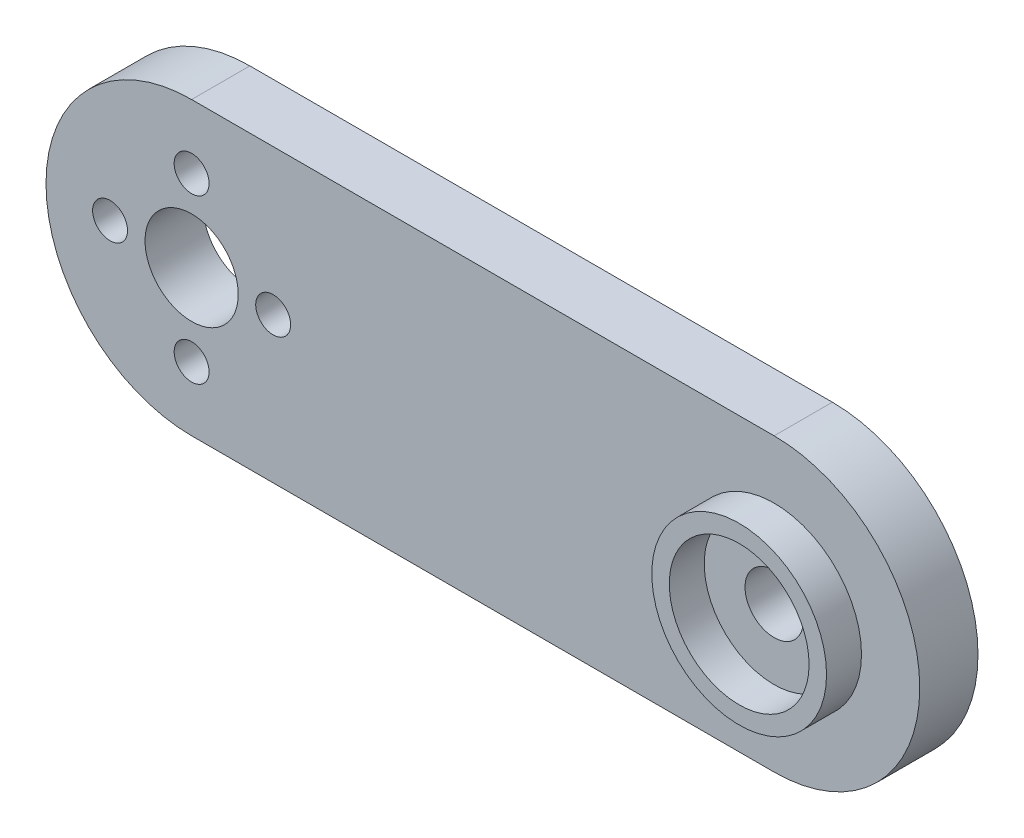
from build123d import *

# Parameters (mm, degrees)
SKETCH1_R           = 12.5
SKETCH1_W           = 50
SKETCH1_H           = 25
BOSS_EXTRUDE2_DEPTH = 5
CUT_EXTRUDE3_REACH  = 69.5
SKETCH3_R           = 4
SKETCH3_R_2         = 2.5
SKETCH3_3_R         = 7.5
SKETCH3_3_R_2       = 6
BOSS_EXTRUDE3_DEPTH = 3
CUT_EXTRUDE4_REACH  = 69.5
SKETCH3_4_R         = 1.5


with BuildPart() as part:
    # Sketch1 → Boss-Extrude2 (new body)
    with BuildSketch(Plane.XY):
        with Locations((0, 12.5)):
            Circle(SKETCH1_R)
        with Locations((50, 12.5)):
            Circle(SKETCH1_R)
        with Locations((25, 12.5)):
            Rectangle(SKETCH1_W, SKETCH1_H)
    extrude(amount=BOSS_EXTRUDE2_DEPTH)

    # Sketch3 → Cut-Extrude3 (cut, up to next)
    with BuildSketch(Plane.XY.offset(5), mode=Mode.PRIVATE) as cut_extrude3_sk1:
        with Locations((0, 12.5)):
            Circle(SKETCH3_R)
    cut_extrude3_tool1 = extrude(cut_extrude3_sk1.sketch, amount=-CUT_EXTRUDE3_REACH, mode=Mode.PRIVATE) & part.part
    # Sketch3 → Cut-Extrude3 (cut, up to next)
    with BuildSketch(Plane.XY.offset(5), mode=Mode.PRIVATE) as cut_extrude3_sk2:
        with Locations((50, 12.5)):
            Circle(SKETCH3_R_2)
    cut_extrude3_tool2 = extrude(cut_extrude3_sk2.sketch, amount=-CUT_EXTRUDE3_REACH, mode=Mode.PRIVATE) & part.part
    add(cut_extrude3_tool1.solids().sort_by_distance((0, 12.5, 5))[0], mode=Mode.SUBTRACT)
    add(cut_extrude3_tool2.solids().sort_by_distance((50, 12.5, 5))[0], mode=Mode.SUBTRACT)

    # Sketch3<3> → Boss-Extrude3 (add)
    with BuildSketch(Plane.XY.offset(5)):
        with Locations((50, 12.5)):
            Circle(SKETCH3_3_R)
        with Locations((50, 12.5)):
            Circle(SKETCH3_3_R_2, mode=Mode.SUBTRACT)
    extrude(amount=BOSS_EXTRUDE3_DEPTH)

    # Sketch3<4> → Cut-Extrude4 (cut, up to next)
    with BuildSketch(Plane.XY.offset(5), mode=Mode.PRIVATE) as cut_extrude4_sk1:
        with Locations((-7, 12.5)):
            Circle(SKETCH3_4_R)
    cut_extrude4_tool1 = extrude(cut_extrude4_sk1.sketch, amount=-CUT_EXTRUDE4_REACH, mode=Mode.PRIVATE) & part.part
    # Sketch3<4> → Cut-Extrude4 (cut, up to next)
    with BuildSketch(Plane.XY.offset(5), mode=Mode.PRIVATE) as cut_extrude4_sk2:
        with Locations((0, 19.5)):
            Circle(SKETCH3_4_R)
    cut_extrude4_tool2 = extrude(cut_extrude4_sk2.sketch, amount=-CUT_EXTRUDE4_REACH, mode=Mode.PRIVATE) & part.part
    # Sketch3<4> → Cut-Extrude4 (cut, up to next)
    with BuildSketch(Plane.XY.offset(5), mode=Mode.PRIVATE) as cut_extrude4_sk3:
        with Locations((7, 12.5)):
            Circle(SKETCH3_4_R)
    cut_extrude4_tool3 = extrude(cut_extrude4_sk3.sketch, amount=-CUT_EXTRUDE4_REACH, mode=Mode.PRIVATE) & part.part
    # Sketch3<4> → Cut-Extrude4 (cut, up to next)
    with BuildSketch(Plane.XY.offset(5), mode=Mode.PRIVATE) as cut_extrude4_sk4:
        with Locations((0, 5.5)):
            Circle(SKETCH3_4_R)
    cut_extrude4_tool4 = extrude(cut_extrude4_sk4.sketch, amount=-CUT_EXTRUDE4_REACH, mode=Mode.PRIVATE) & part.part
    add(cut_extrude4_tool1.solids().sort_by_distance((-7, 12.5, 5))[0], mode=Mode.SUBTRACT)
    add(cut_extrude4_tool2.solids().sort_by_distance((0, 19.5, 5))[0], mode=Mode.SUBTRACT)
    add(cut_extrude4_tool3.solids().sort_by_distance((7, 12.5, 5))[0], mode=Mode.SUBTRACT)
    add(cut_extrude4_tool4.solids().sort_by_distance((0, 5.5, 5))[0], mode=Mode.SUBTRACT)


solid = part.part
